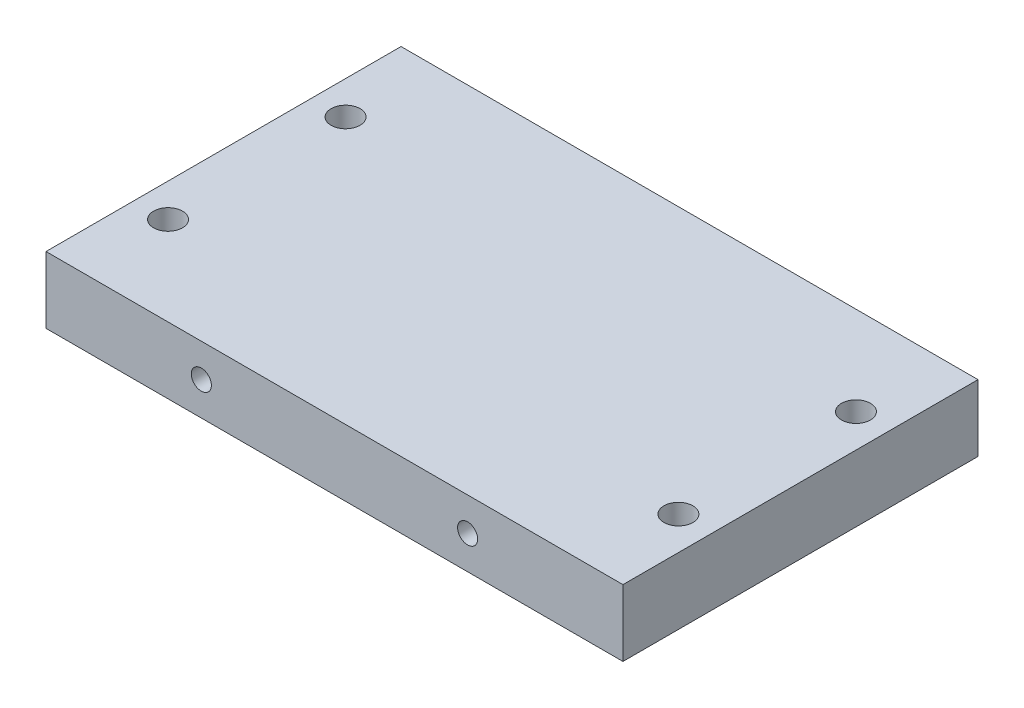
from build123d import *

# Parameters (mm, degrees)
SKETCH1_W                                      = 65
SKETCH1_H                                      = 40
BOSS_EXTRUDE1_DEPTH                            = 7.5
F_4_40_TAPPED_HOLE1_D                          = 2.2606
F_4_40_TAPPED_HOLE1_DEPTH                      = 7.6
F_4_40_TAPPED_HOLE1_TIP                        = 0.679152758
F_4_40_TAPPED_HOLE2_D                          = 2.2606
F_4_40_TAPPED_HOLE2_DEPTH                      = 7.6
F_4_40_TAPPED_HOLE2_TIP                        = 0.679152758
CBORE_FOR_4_SOCKET_HEAD_CAP_SCREW1_D           = 3.2639
CBORE_FOR_4_SOCKET_HEAD_CAP_SCREW1_CBORE_D     = 5.55752
CBORE_FOR_4_SOCKET_HEAD_CAP_SCREW1_CBORE_DEPTH = 2.8448


with BuildPart() as part:
    # Sketch1 → Boss-Extrude1 (new body)
    with BuildSketch(Plane(origin=(0, 0, 0), x_dir=(1, 0, 0), z_dir=(0, 1, 0))):
        Rectangle(SKETCH1_W, SKETCH1_H)
    extrude(amount=BOSS_EXTRUDE1_DEPTH)

    # #4-40 Tapped Hole1
    with Locations(Plane.XY.offset(20)):
        with Locations((-15, 3.75), (15, 3.75)):
            Hole(F_4_40_TAPPED_HOLE1_D / 2, depth=F_4_40_TAPPED_HOLE1_DEPTH)
            with Locations((0, 0, -(F_4_40_TAPPED_HOLE1_DEPTH + F_4_40_TAPPED_HOLE1_TIP / 2))):  # 118° drill point
                Cone(0, F_4_40_TAPPED_HOLE1_D / 2, F_4_40_TAPPED_HOLE1_TIP, mode=Mode.SUBTRACT)

    # #4-40 Tapped Hole2
    with Locations(Plane(origin=(0, 0, -20), x_dir=(-1, 0, 0), z_dir=(0, 0, -1))):
        with Locations((-15, 3.75), (15, 3.75)):
            Hole(F_4_40_TAPPED_HOLE2_D / 2, depth=F_4_40_TAPPED_HOLE2_DEPTH)
            with Locations((0, 0, -(F_4_40_TAPPED_HOLE2_DEPTH + F_4_40_TAPPED_HOLE2_TIP / 2))):  # 118° drill point
                Cone(0, F_4_40_TAPPED_HOLE2_D / 2, F_4_40_TAPPED_HOLE2_TIP, mode=Mode.SUBTRACT)

    # CBORE for #4 Socket Head Cap Screw1 (through all)
    with Locations(Plane(origin=(0, 0, 0), x_dir=(-1, 0, 0), z_dir=(0, -1, 0))):
        with Locations((-28.75, -10), (-28.75, 10), (28.75, 10), (28.75, -10)):
            CounterBoreHole(CBORE_FOR_4_SOCKET_HEAD_CAP_SCREW1_D / 2, CBORE_FOR_4_SOCKET_HEAD_CAP_SCREW1_CBORE_D / 2, CBORE_FOR_4_SOCKET_HEAD_CAP_SCREW1_CBORE_DEPTH)


solid = part.part
